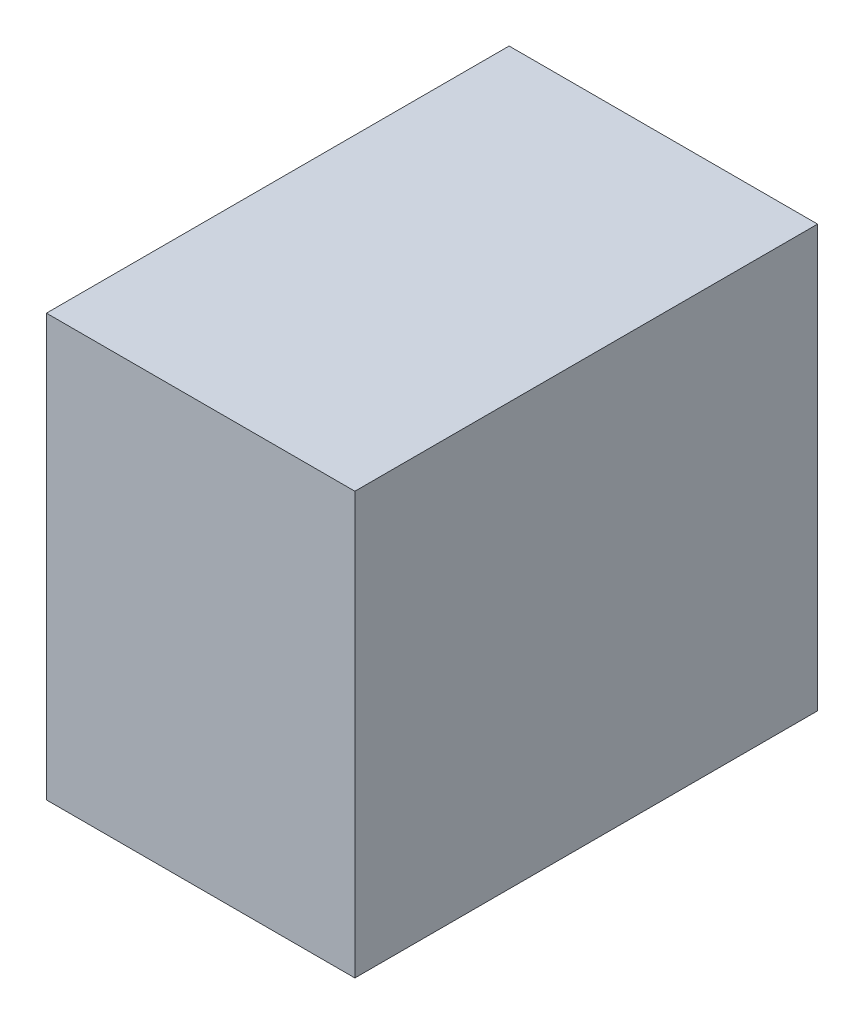
from build123d import *

# Parameters (mm, degrees)
SKETCH1_W           = 60
SKETCH1_H           = 82
BOSS_EXTRUDE1_DEPTH = 90


with BuildPart() as part:
    # Sketch1 → Boss-Extrude1 (new body)
    with BuildSketch(Plane.XY):
        Rectangle(SKETCH1_W, SKETCH1_H)
    extrude(amount=BOSS_EXTRUDE1_DEPTH)


solid = part.part
